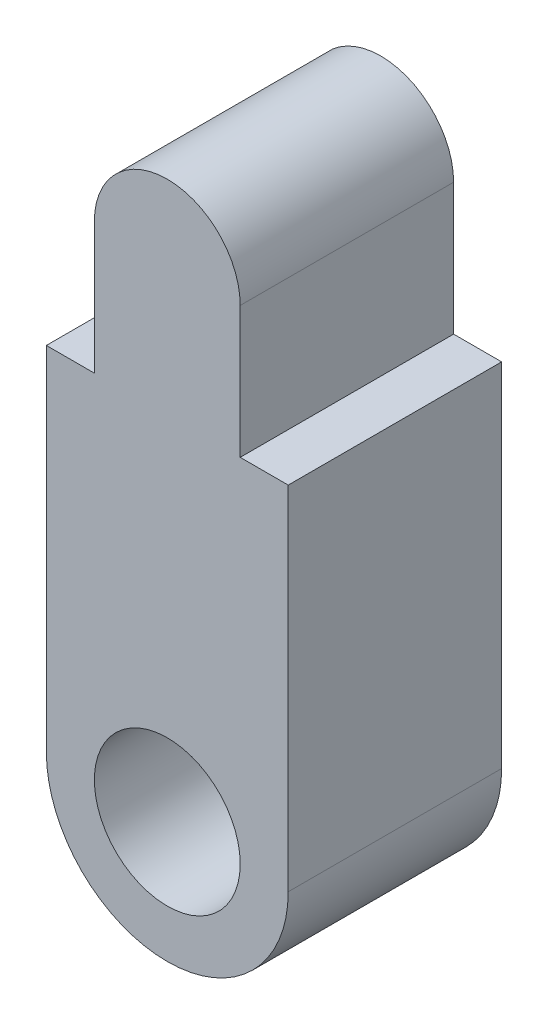
from build123d import *

# Parameters (mm, degrees)
SKETCH1_W           = 20.5
SKETCH1_H           = 5
BOSS_EXTRUDE1_DEPTH = 30


with BuildPart() as part:
    # Sketch1 → Boss-Extrude1 (new body)
    with BuildSketch(Plane.XY):
        with BuildLine():
            Line((17, -18.493179267), (10.25, -18.493179267))
            Line((10.25, -18.493179267), (10.25, -68))
            ThreePointArc((10.25, -68), (0, -78.25), (-10.25, -68))
            Line((-10.25, -68), (-10.25, -18.493179267))
            Line((-10.25, -18.493179267), (-17, -18.493179267))
            Line((-17, -18.493179267), (-17, -68))
            ThreePointArc((-17, -68), (0, -85), (17, -68))
            Line((17, -68), (17, -18.493179267))
        make_face()
        with BuildLine():
            Line((10.25, -68), (10.25, -18.493179267))
            Line((10.25, -18.493179267), (-10.25, -18.493179267))
            Line((-10.25, -18.493179267), (-10.25, -68))
            ThreePointArc((-10.25, -68), (0, -57.75), (10.25, -68))
        make_face()
        with Locations((0, -15.993179267)):
            Rectangle(SKETCH1_W, SKETCH1_H)
        with BuildLine():
            Line((10.25, -13.493179267), (10.25, 0))
            ThreePointArc((10.25, 0), (0, -10.25), (-10.25, 0))
            Line((-10.25, 0), (-10.25, -13.493179267))
            Line((-10.25, -13.493179267), (10.25, -13.493179267))
        make_face()
        with BuildLine():
            ThreePointArc((-10.25, 0), (0, -10.25), (10.25, 0))
            Line((10.25, 0), (-10.25, 0))
        make_face()
        with BuildLine():
            Line((-10.25, 0), (10.25, 0))
            ThreePointArc((10.25, 0), (0, 10.25), (-10.25, 0))
        make_face()
    extrude(amount=BOSS_EXTRUDE1_DEPTH)


solid = part.part
